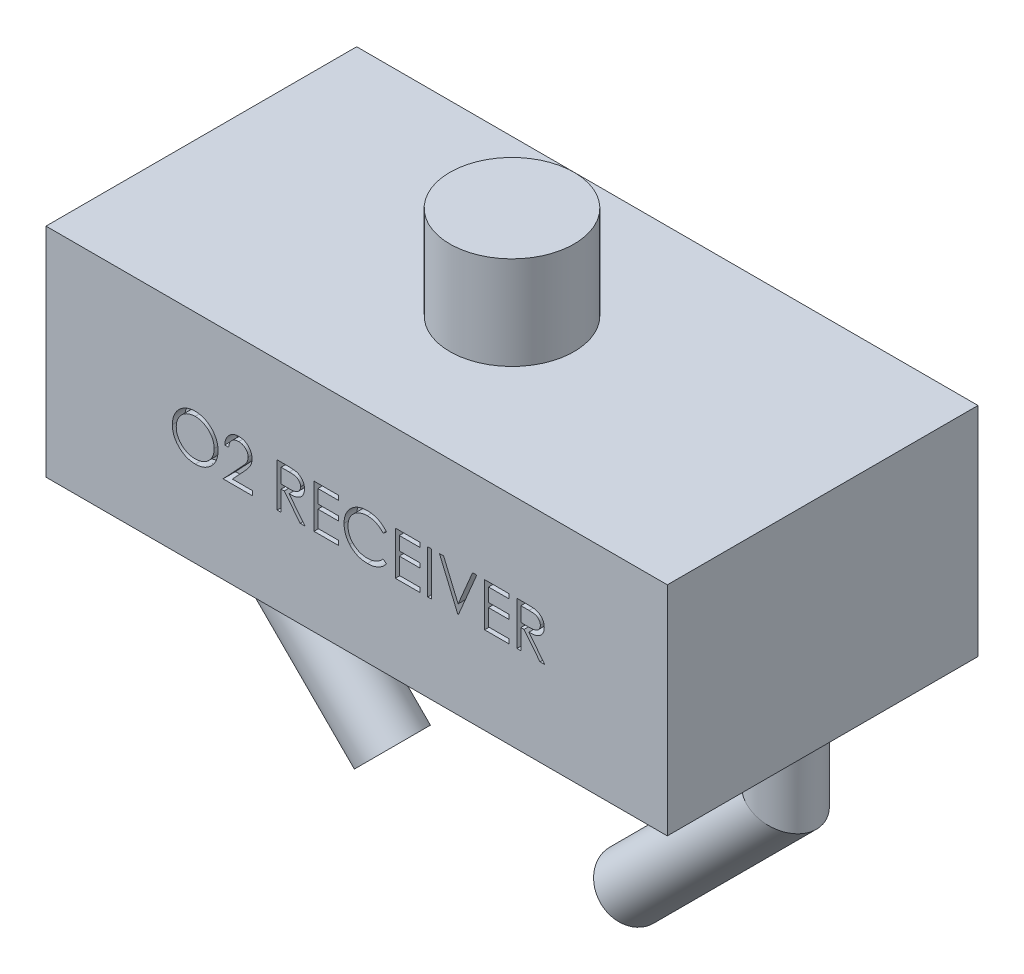
from build123d import *

# Parameters (mm, degrees)
SKETCH1_W           = 50
SKETCH1_H           = 17.5
BOSS_EXTRUDE1_DEPTH = 12.5
SKETCH2_W           = 0.314102564
SKETCH2_H           = 3.5
CUT_EXTRUDE1_DEPTH  = 1
SKETCH3_R           = 5
BOSS_EXTRUDE2_DEPTH = 7.5
SKETCH5_R           = 2.5


with BuildPart() as part:
    # Sketch1 → Boss-Extrude1 (new, symmetric)
    with BuildSketch(Plane.XY):
        Rectangle(SKETCH1_W, SKETCH1_H)
    extrude(amount=BOSS_EXTRUDE1_DEPTH, both=True)

    # Sketch2 → Cut-Extrude1 (cut)
    # profile 1 of 10: a face of its own
    with BuildSketch(Plane.XY.offset(12.5)):
        with BuildLine():
            add(Edge.make_bspline(
                [(-13.016466153, 1.851146313), (-12.951658047, 1.849504833), (-12.82436958, 1.846280832), (-12.637294682, 1.821601729), (-12.458699587, 1.778906339), (-12.287129448, 1.722043356), (-12.124636472, 1.646188971), (-11.969997579, 1.554503823), (-11.823580705, 1.446027364), (-11.687359324, 1.321598137), (-11.562702373, 1.186214683), (-11.452876487, 1.041736773), (-11.360834193, 0.889037971), (-11.285248406, 0.72857714), (-11.225949797, 0.560717172), (-11.185030753, 0.38456317), (-11.158892603, 0.201256479), (-11.155836825, 0.076229615), (-11.154286666, 0.012804967)],
                knots=[0, 0, 0, 0, 1.065120563, 2.091984664, 3.0946048, 4.079830382, 5.057816894, 6.036188127, 7.030412546, 8.04752943, 9.064399622, 10.05169764, 11.02544977, 11.989514704, 12.962713494, 13.945757189, 14.957906945, 16, 16, 16, 16], degree=3))
            add(Edge.make_bspline(
                [(-11.154286666, 0.012804967), (-11.155836598, -0.05015248), (-11.158891695, -0.1742489), (-11.185060472, -0.356392344), (-11.226101472, -0.531483041), (-11.284697738, -0.699228694), (-11.359923217, -0.859806257), (-11.452578388, -1.012793211), (-11.561719599, -1.15823971), (-11.68592645, -1.294552375), (-11.821327492, -1.419549846), (-11.966557759, -1.528468721), (-12.118351079, -1.622192846), (-12.278660787, -1.69697652), (-12.445360823, -1.75674844), (-12.619943147, -1.79750107), (-12.801589701, -1.823788114), (-12.925460704, -1.826806629), (-12.988421281, -1.828340867)],
                knots=[0, 0, 0, 0, 1.043624062, 2.057103931, 3.04512605, 4.022047818, 4.998200453, 5.980619268, 6.982898556, 8.009068085, 9.034988726, 10.034168286, 11.015286542, 11.987931943, 12.962482838, 13.94673481, 14.956375938, 16, 16, 16, 16], degree=3))
            add(Edge.make_bspline(
                [(-12.988421281, -1.828340867), (-13.0518456, -1.82679148), (-13.176871816, -1.823737226), (-13.360408851, -1.797555821), (-13.536686595, -1.756614517), (-13.705200946, -1.698105081), (-13.866045876, -1.62248785), (-14.019535959, -1.530283471), (-14.165055106, -1.42087633), (-14.301396852, -1.296709756), (-14.426146051, -1.161538204), (-14.534905426, -1.016703948), (-14.62713054, -0.865048492), (-14.702493872, -0.706150968), (-14.762158331, -0.540779525), (-14.80286315, -0.367831048), (-14.829199102, -0.188291542), (-14.832233948, -0.066048643), (-14.833773845, -0.004021956)],
                knots=[0, 0, 0, 0, 1.053102029, 2.075944431, 3.073151272, 4.055350789, 5.033113405, 6.020478099, 7.024410459, 8.052272461, 9.079885166, 10.07527673, 11.055994387, 12.023226415, 12.992069828, 13.970394897, 14.97016774, 16, 16, 16, 16], degree=3))
            add(Edge.make_bspline(
                [(-14.833773845, -0.004021956), (-14.83323921, 0.037610713), (-14.832176683, 0.120350836), (-14.819384991, 0.243217436), (-14.80082329, 0.364108094), (-14.774221377, 0.482679042), (-14.73942971, 0.598640027), (-14.698377683, 0.71279079), (-14.648237837, 0.823974513), (-14.591557189, 0.932717905), (-14.528295381, 1.037325811), (-14.458419632, 1.136205394), (-14.384384263, 1.230186391), (-14.30322087, 1.316833395), (-14.217604424, 1.398667051), (-14.126146046, 1.474429768), (-14.029403802, 1.544804719), (-13.926961422, 1.60822506), (-13.821343147, 1.665584195), (-13.71246637, 1.714806046), (-13.601809798, 1.757052107), (-13.48885515, 1.791292932), (-13.373902378, 1.818324968), (-13.256700593, 1.836732322), (-13.137343167, 1.84955664), (-13.056931848, 1.850614142), (-13.016466153, 1.851146313)],
                knots=[0, 0, 0, 0, 1.037015668, 2.060948919, 3.074880161, 4.083647147, 5.086022904, 6.090072063, 7.104153813, 8.122640571, 9.144368836, 10.147691507, 11.138137339, 12.123020368, 13.103399296, 14.087645067, 15.080126199, 16.082011238, 17.087798457, 18.072939717, 19.057185487, 20.037253025, 21.01195951, 21.997135196, 22.992090687, 24, 24, 24, 24], degree=3))
        make_face()
        with BuildLine():
            add(Edge.make_bspline(
                [(-13.001041473, 1.492171954), (-13.034256107, 1.491767064), (-13.10036784, 1.490961154), (-13.198652376, 1.480345438), (-13.29564431, 1.465215549), (-13.391363672, 1.443634029), (-13.485409961, 1.414229976), (-13.578659803, 1.380389068), (-13.670262856, 1.339167977), (-13.759916714, 1.292595273), (-13.846831789, 1.241046352), (-13.928844491, 1.184074585), (-14.006167135, 1.12301603), (-14.078610402, 1.057728193), (-14.145961574, 0.987878591), (-14.209546275, 0.914526155), (-14.266815857, 0.835574264), (-14.319301434, 0.753163857), (-14.366269274, 0.667402276), (-14.408034629, 0.579192414), (-14.442198637, 0.487814727), (-14.470061014, 0.394260569), (-14.493160825, 0.29867811), (-14.507794749, 0.200342261), (-14.518527108, 0.099747149), (-14.519286954, 0.031765295), (-14.519671281, -0.002619713)],
                knots=[0, 0, 0, 0, 1.008559885, 2.007477868, 2.99961109, 3.989939068, 4.984837346, 5.991145699, 7.001802488, 8.033829008, 9.059044045, 10.069351652, 11.065060232, 12.050310815, 13.029377138, 14.011219647, 14.996725999, 15.989392538, 16.977580475, 17.965360261, 18.951710183, 19.937753436, 20.929683414, 21.935841486, 22.955955122, 24, 24, 24, 24], degree=3))
            add(Edge.make_bspline(
                [(-14.519671281, -0.002619713), (-14.518396419, -0.053181934), (-14.515888371, -0.152653464), (-14.493930801, -0.298421608), (-14.460108827, -0.438509894), (-14.41025146, -0.572151803), (-14.347900846, -0.700496086), (-14.270873955, -0.822404191), (-14.17961487, -0.937909065), (-14.075951343, -1.046204334), (-13.962628636, -1.145050139), (-13.842295907, -1.231813547), (-13.716242299, -1.305223797), (-13.584139096, -1.365028869), (-13.446691557, -1.412418607), (-13.303014006, -1.444897238), (-13.154063547, -1.466272694), (-13.052532892, -1.46832545), (-13.001041473, -1.469366508)],
                knots=[0, 0, 0, 0, 1.032063989, 2.030389145, 3.003944642, 3.970395727, 4.937377036, 5.913328081, 6.909231446, 7.93887556, 8.970685674, 9.976071282, 10.964166581, 11.944589148, 12.933237628, 13.927779006, 14.949070134, 16, 16, 16, 16], degree=3))
            add(Edge.make_bspline(
                [(-13.001041473, -1.469366508), (-12.966431972, -1.468891003), (-12.897790935, -1.467947935), (-12.795695413, -1.458449259), (-12.695439201, -1.443217389), (-12.597162921, -1.421286734), (-12.50097811, -1.393839527), (-12.406483307, -1.361231799), (-12.314685017, -1.320550595), (-12.224425179, -1.275602644), (-12.138028937, -1.224362486), (-12.055553405, -1.169324337), (-11.979077425, -1.108355716), (-11.906688353, -1.044037903), (-11.839060664, -0.975074056), (-11.77665168, -0.901553834), (-11.719671548, -0.823013177), (-11.667205901, -0.740727771), (-11.620402639, -0.654731518), (-11.57962354, -0.56620184), (-11.545027424, -0.475356731), (-11.517098919, -0.382065159), (-11.495213457, -0.286504311), (-11.480133537, -0.188546232), (-11.469585099, -0.08838689), (-11.468790022, -0.020643034), (-11.46838923, 0.013506088)],
                knots=[0, 0, 0, 0, 1.047197238, 2.076906641, 3.100256066, 4.114471768, 5.12198147, 6.126382909, 7.136867548, 8.15857795, 9.17633901, 10.174870724, 11.156907918, 12.133735059, 13.104061851, 14.077631395, 15.04955518, 16.038496417, 17.029181396, 18.010275684, 18.986308667, 19.968651475, 20.955262928, 21.950658345, 22.966943676, 24, 24, 24, 24], degree=3))
            add(Edge.make_bspline(
                [(-11.46838923, 0.013506088), (-11.468790343, 0.047421593), (-11.469586024, 0.114699243), (-11.480128499, 0.214160061), (-11.495229389, 0.311413273), (-11.516992097, 0.406077076), (-11.545042251, 0.498175601), (-11.579629581, 0.587622348), (-11.620414881, 0.674750544), (-11.667223105, 0.759344841), (-11.719838929, 0.840519579), (-11.777333172, 0.918121991), (-11.84069852, 0.990694732), (-11.908124545, 1.060029426), (-11.98129543, 1.124647316), (-12.059879724, 1.184569837), (-12.142923402, 1.241243111), (-12.230850638, 1.292368673), (-12.321594591, 1.339582906), (-12.414708549, 1.380033909), (-12.509137649, 1.414406028), (-12.604641761, 1.443722993), (-12.70202474, 1.465131023), (-12.800628568, 1.480359073), (-12.900316827, 1.490957459), (-12.967360047, 1.491765838), (-13.001041473, 1.492171954)],
                knots=[0, 0, 0, 0, 1.02996197, 2.043119294, 3.035359645, 4.018872909, 4.991431989, 5.957985074, 6.929999688, 7.912076566, 8.892894881, 9.867085534, 10.843653904, 11.817741046, 12.803660682, 13.806313499, 14.818574707, 15.856120519, 16.894564902, 17.924820532, 18.937903209, 19.946497019, 20.957711757, 21.963978472, 22.977135795, 24, 24, 24, 24], degree=3))
        make_face(mode=Mode.SUBTRACT)
    # profile 2 of 10: a face of its own
    with BuildSketch(Plane.XY.offset(12.5)):
        with BuildLine():
            Line((-10.301722563, 0.684479646), (-10.615825127, 0.684479646))
            add(Edge.make_bspline(
                [(-10.615825127, 0.684479646), (-10.613777974, 0.726150534), (-10.60975742, 0.807991048), (-10.590929131, 0.927314955), (-10.563988254, 1.041369754), (-10.5258968, 1.149239668), (-10.478590522, 1.251878475), (-10.421860494, 1.34887849), (-10.354666644, 1.439869679), (-10.27845991, 1.524008522), (-10.195691271, 1.601196093), (-10.106385331, 1.667851336), (-10.012540304, 1.724169007), (-9.914440905, 1.771250249), (-9.810980342, 1.806590095), (-9.703097484, 1.832811735), (-9.590318347, 1.848588081), (-9.513478325, 1.850283866), (-9.474398845, 1.851146313)],
                knots=[0, 0, 0, 0, 1.10065271, 2.161652631, 3.183658789, 4.190468796, 5.17591951, 6.163126047, 7.15150782, 8.156236427, 9.156009102, 10.134482811, 11.092018607, 12.041330605, 13.001268258, 13.972401359, 14.968799086, 16, 16, 16, 16], degree=3))
            add(Edge.make_bspline(
                [(-9.474398845, 1.851146313), (-9.436020771, 1.850247856), (-9.360609226, 1.848482421), (-9.250547212, 1.833321392), (-9.145769917, 1.809575801), (-9.046482151, 1.776260384), (-8.953476086, 1.731475957), (-8.866053042, 1.677678418), (-8.783172231, 1.615458587), (-8.708565447, 1.542204773), (-8.640057368, 1.464002389), (-8.580955113, 1.380514485), (-8.53034195, 1.2942852), (-8.48815427, 1.204656998), (-8.457098131, 1.11078597), (-8.433519923, 1.014038767), (-8.420192509, 0.913413956), (-8.418147085, 0.8453074), (-8.417107178, 0.810681569)],
                knots=[0, 0, 0, 0, 1.111607364, 2.184268762, 3.212621178, 4.221274766, 5.211760367, 6.196651075, 7.1921475, 8.207485113, 9.220403448, 10.201281604, 11.166441695, 12.114753415, 13.065576456, 14.026450734, 14.996634279, 16, 16, 16, 16], degree=3))
            add(Edge.make_bspline(
                [(-8.417107178, 0.810681569), (-8.418800441, 0.761933735), (-8.422157253, 0.665293521), (-8.450871629, 0.523278658), (-8.49571814, 0.385685239), (-8.549715497, 0.274947937), (-8.604187941, 0.185714443), (-8.653275449, 0.112245738), (-8.71074026, 0.03314027), (-8.777418758, -0.051337067), (-8.85193163, -0.141847973), (-8.934953793, -0.238337768), (-9.027077275, -0.339809538), (-9.091735776, -0.409115139), (-9.125240191, -0.445027565)],
                knots=[0, 0, 0, 0, 1.184426356, 2.348067706, 3.509069118, 4.696110526, 5.333549288, 6.050745305, 6.844228056, 7.710549037, 8.667450064, 9.695053472, 10.805634456, 12, 12, 12, 12], degree=3))
            Line((-9.125240191, -0.445027565), (-10.000941313, -1.379622918))
            Line((-10.000941313, -1.379622918), (-8.372235384, -1.379622918))
            Line((-8.372235384, -1.379622918), (-8.372235384, -1.738597277))
            Line((-8.372235384, -1.738597277), (-10.750440512, -1.738597277))
            Line((-10.750440512, -1.738597277), (-9.393068717, -0.290079649))
            add(Edge.make_bspline(
                [(-9.393068717, -0.290079649), (-9.36002083, -0.255581342), (-9.296542603, -0.189317156), (-9.206760026, -0.092574195), (-9.126121038, -0.002824655), (-9.054103645, 0.079761894), (-8.99227014, 0.156393462), (-8.937397908, 0.224588165), (-8.893432317, 0.287342615), (-8.845716921, 0.360083229), (-8.79950294, 0.448895546), (-8.759790584, 0.557429236), (-8.735575735, 0.669156488), (-8.7326709, 0.744658525), (-8.731209743, 0.782636697)],
                knots=[0, 0, 0, 0, 1.329631726, 2.553950428, 3.673215718, 4.687767853, 5.603093632, 6.413772471, 7.123043292, 7.734684054, 8.834405432, 9.900288307, 10.943827018, 12, 12, 12, 12], degree=3))
            add(Edge.make_bspline(
                [(-8.731209743, 0.782636697), (-8.731845485, 0.806518096), (-8.733098411, 0.853583746), (-8.744156108, 0.922589505), (-8.760866614, 0.989154319), (-8.784811872, 1.053482938), (-8.816418613, 1.11492859), (-8.854891992, 1.17356607), (-8.899282056, 1.230255036), (-8.950633325, 1.283408334), (-9.007044845, 1.332089539), (-9.066639095, 1.375213625), (-9.129689199, 1.411252735), (-9.195929321, 1.440796233), (-9.26517479, 1.463971614), (-9.337559536, 1.480030193), (-9.412883552, 1.490112677), (-9.464317048, 1.491476849), (-9.490524646, 1.492171954)],
                knots=[0, 0, 0, 0, 0.991446411, 1.95395049, 2.89581595, 3.838931463, 4.798493298, 5.75982156, 6.748411868, 7.785213223, 8.824556874, 9.840280684, 10.836137867, 11.835679398, 12.848801643, 13.863922112, 14.911575587, 16, 16, 16, 16], degree=3))
            add(Edge.make_bspline(
                [(-9.490524646, 1.492171954), (-9.517895479, 1.491456922), (-9.571647275, 1.490052716), (-9.650566308, 1.480230052), (-9.725852086, 1.463284212), (-9.797693989, 1.440107537), (-9.866213575, 1.410648989), (-9.931077619, 1.373957244), (-9.992140508, 1.330173751), (-10.049517031, 1.280533194), (-10.10238101, 1.225265593), (-10.148827886, 1.16365563), (-10.1894119, 1.096828215), (-10.224821134, 1.024963664), (-10.253576824, 0.947409884), (-10.275549974, 0.864442179), (-10.292936821, 0.776420798), (-10.298745342, 0.715635713), (-10.301722563, 0.684479646)],
                knots=[0, 0, 0, 0, 1.031018746, 2.02475058, 2.990194455, 3.934040569, 4.864654155, 5.795059489, 6.735614925, 7.690564532, 8.649604399, 9.611025574, 10.590972636, 11.591080095, 12.624614302, 13.701020113, 14.821632451, 16, 16, 16, 16], degree=3))
        make_face()
    # profile 3 of 10: a face of its own
    with BuildSketch(Plane.XY.offset(12.5)):
        with BuildLine():
            Line((-6.397876409, 1.761402723), (-5.697455736, 1.761402723))
            add(Edge.make_bspline(
                [(-5.697455736, 1.761402723), (-5.650714608, 1.761247137), (-5.560966463, 1.760948395), (-5.432393193, 1.759282632), (-5.315566096, 1.754508276), (-5.210546257, 1.750399693), (-5.117335602, 1.742907751), (-5.035648311, 1.735747104), (-4.965860613, 1.726373443), (-4.923614762, 1.71766802), (-4.904486986, 1.713726441)],
                knots=[0, 0, 0, 0, 1.410062039, 2.707475311, 3.878576406, 4.937260626, 5.877586885, 6.699081471, 7.410979367, 8, 8, 8, 8], degree=3))
            add(Edge.make_bspline(
                [(-4.904486986, 1.713726441), (-4.878880362, 1.707399676), (-4.828213373, 1.694881112), (-4.755263306, 1.668421511), (-4.685748983, 1.637801887), (-4.619959158, 1.601838166), (-4.558223367, 1.560263387), (-4.499905056, 1.513795264), (-4.444739593, 1.462688058), (-4.394957963, 1.405653217), (-4.348018911, 1.345816707), (-4.308430284, 1.28111295), (-4.274303805, 1.213451423), (-4.247133288, 1.142144005), (-4.225255314, 1.067882233), (-4.209829075, 0.989993436), (-4.200577887, 0.908832461), (-4.199636032, 0.853474553), (-4.19915846, 0.825405127)],
                knots=[0, 0, 0, 0, 1.027469482, 2.033020251, 3.019912614, 3.986113645, 4.951240523, 5.91722682, 6.890402269, 7.87763091, 8.8651537, 9.85103654, 10.82876324, 11.815024772, 12.821070561, 13.842952187, 14.906261191, 16, 16, 16, 16], degree=3))
            add(Edge.make_bspline(
                [(-4.19915846, 0.825405127), (-4.200627459, 0.778770022), (-4.203493854, 0.687772854), (-4.230218958, 0.555711973), (-4.273995478, 0.432522658), (-4.334318767, 0.31836002), (-4.411138243, 0.215449375), (-4.503463034, 0.12505892), (-4.611344645, 0.049419007), (-4.711773961, -0.003033798), (-4.800488161, -0.036626706), (-4.873521474, -0.060263065), (-4.953188451, -0.07852503), (-5.038725786, -0.094885162), (-5.130489441, -0.107236856), (-5.228259481, -0.116283451), (-5.332105632, -0.1219375), (-5.403444701, -0.122779505), (-5.440144037, -0.123212662)],
                knots=[0, 0, 0, 0, 1.260483769, 2.459530307, 3.627416485, 4.787058657, 5.939039949, 7.08810263, 8.267026773, 9.491475466, 10.141966685, 10.831826277, 11.566392101, 12.351337768, 13.187381173, 14.07005841, 15.007169909, 16, 16, 16, 16], degree=3))
            Line((-5.440144037, -0.123212662), (-4.154286666, -1.738597277))
            Line((-4.154286666, -1.738597277), (-4.54270814, -1.738597277))
            Line((-4.54270814, -1.738597277), (-5.828565512, -0.123212662))
            Line((-5.828565512, -0.123212662), (-6.083773845, -0.123212662))
            Line((-6.083773845, -0.123212662), (-6.083773845, -1.738597277))
            Line((-6.083773845, -1.738597277), (-6.397876409, -1.738597277))
            Line((-6.397876409, -1.738597277), (-6.397876409, 1.761402723))
        make_face()
        with BuildLine():
            Line((-6.083773845, 1.402428364), (-6.083773845, 0.235761697))
            Line((-6.083773845, 0.235761697), (-5.442948525, 0.230853845))
            add(Edge.make_bspline(
                [(-5.442948525, 0.230853845), (-5.413028486, 0.230840608), (-5.355034929, 0.230814952), (-5.271134264, 0.234808728), (-5.193014152, 0.239352046), (-5.1209734, 0.246301392), (-5.054979825, 0.255257464), (-4.995066411, 0.266460448), (-4.941135359, 0.27951251), (-4.878236821, 0.299714136), (-4.80800029, 0.331720154), (-4.73166883, 0.378285653), (-4.666666492, 0.436854772), (-4.61174863, 0.503828228), (-4.567619198, 0.577464477), (-4.536507144, 0.656880846), (-4.516764702, 0.740072444), (-4.514436156, 0.797250552), (-4.513261025, 0.826106249)],
                knots=[0, 0, 0, 0, 1.146690395, 2.22261258, 3.21895312, 4.145990853, 4.996080663, 5.770904154, 6.481378293, 7.121626537, 8.300444488, 9.431385265, 10.535395872, 11.636531494, 12.74115979, 13.810798291, 14.895190096, 16, 16, 16, 16], degree=3))
            add(Edge.make_bspline(
                [(-4.513261025, 0.826106249), (-4.514463146, 0.854252822), (-4.516845311, 0.910029061), (-4.53629408, 0.991684971), (-4.569183461, 1.068751921), (-4.613505699, 1.140916406), (-4.667504854, 1.206422142), (-4.730822666, 1.262469295), (-4.801727862, 1.30871876), (-4.86799906, 1.338273141), (-4.927233272, 1.356392994), (-4.978662933, 1.369144158), (-5.03677441, 1.379388627), (-5.101849869, 1.387596687), (-5.1736115, 1.394651632), (-5.252422151, 1.39940341), (-5.337758931, 1.402217274), (-5.396905862, 1.402356363), (-5.427523845, 1.402428364)],
                knots=[0, 0, 0, 0, 1.101028733, 2.181837193, 3.264309656, 4.369019818, 5.486613113, 6.575447106, 7.666700264, 8.788928104, 9.402425223, 10.0903467, 10.862060571, 11.710948788, 12.657782767, 13.684531032, 14.801375019, 16, 16, 16, 16], degree=3))
            Line((-5.427523845, 1.402428364), (-6.083773845, 1.402428364))
        make_face(mode=Mode.SUBTRACT)
    # profile 4 of 10: a face of its own
    with BuildSketch(Plane.XY.offset(12.5)):
        Polygon((-3.436337948, 1.761402723), (-1.461978973, 1.761402723), (-1.461978973, 1.402428364), (-3.122235384, 1.402428364), (-3.122235384, 0.325505287), (-1.461978973, 0.325505287), (-1.461978973, -0.033469072), (-3.122235384, -0.033469072), (-3.122235384, -1.379622918), (-1.461978973, -1.379622918), (-1.461978973, -1.738597277), (-3.436337948, -1.738597277), align=None)
    # profile 5 of 10: a face of its own
    with BuildSketch(Plane.XY.offset(12.5)):
        with BuildLine():
            Line((2.396995386, 1.119175159), (2.122155642, 0.90883862))
            add(Edge.make_bspline(
                [(2.122155642, 0.90883862), (2.102549754, 0.93220459), (2.063602307, 0.978621506), (2.000943104, 1.04380105), (1.935641461, 1.104866312), (1.86772234, 1.162108192), (1.795963221, 1.213524957), (1.722102422, 1.26179606), (1.644904377, 1.305063798), (1.538152642, 1.357526784), (1.398504794, 1.412272939), (1.222709955, 1.458176171), (1.039198856, 1.487397346), (0.914001257, 1.490562188), (0.850320706, 1.492171954)],
                knots=[0, 0, 0, 0, 0.757959112, 1.505699292, 2.245454638, 2.979532153, 3.711538275, 4.438200793, 5.171680507, 5.909471876, 7.393775596, 8.890124382, 10.418191784, 12, 12, 12, 12], degree=3))
            add(Edge.make_bspline(
                [(0.850320706, 1.492171954), (0.815237407, 1.491767991), (0.745396414, 1.490963815), (0.641747941, 1.48035469), (0.54003489, 1.46544348), (0.440323423, 1.443318157), (0.342740465, 1.415345538), (0.246648063, 1.381920124), (0.153437463, 1.340565284), (0.061819225, 1.294857024), (-0.025959986, 1.243229579), (-0.109015034, 1.186916227), (-0.187043002, 1.126547131), (-0.260105614, 1.061896025), (-0.328277562, 0.993254064), (-0.391064873, 0.919889723), (-0.448250283, 0.842037549), (-0.500967308, 0.760724142), (-0.548180042, 0.67618635), (-0.587709921, 0.588111279), (-0.622715043, 0.498007176), (-0.650414286, 0.404856016), (-0.672338803, 0.30931325), (-0.687466466, 0.211122462), (-0.697954937, 0.110488782), (-0.698755114, 0.04227947), (-0.69915846, 0.007897114)],
                knots=[0, 0, 0, 0, 1.054917814, 2.100044995, 3.131103042, 4.146048494, 5.169673617, 6.183595914, 7.203665975, 8.234915748, 9.262203917, 10.264457458, 11.251630812, 12.227803204, 13.197192746, 14.159520551, 15.12972552, 16.100847026, 17.073214652, 18.039054194, 19.002613845, 19.979014051, 20.95965708, 21.949030935, 22.966165397, 24, 24, 24, 24], degree=3))
            add(Edge.make_bspline(
                [(-0.69915846, 0.007897114), (-0.697896641, -0.043834206), (-0.695419227, -0.145401791), (-0.673370893, -0.294172401), (-0.639865802, -0.436693075), (-0.589650225, -0.572072917), (-0.527731174, -0.701981275), (-0.449490563, -0.824220129), (-0.358874025, -0.940636693), (-0.254599606, -1.048479641), (-0.14019379, -1.146993366), (-0.017445878, -1.233743948), (0.113338409, -1.30605883), (0.25071504, -1.366234777), (0.395741153, -1.412491505), (0.548155956, -1.445055628), (0.707627951, -1.466297809), (0.816597351, -1.468331497), (0.872055482, -1.469366508)],
                knots=[0, 0, 0, 0, 1.029171465, 2.020641659, 2.987623507, 3.938342917, 4.889210282, 5.84687017, 6.821220943, 7.821438502, 8.827599549, 9.822697543, 10.807740252, 11.797342354, 12.80366471, 13.83203677, 14.896651826, 16, 16, 16, 16], degree=3))
            add(Edge.make_bspline(
                [(0.872055482, -1.469366508), (0.933158171, -1.467677728), (1.05342288, -1.464353805), (1.229790906, -1.436194556), (1.398626672, -1.390536639), (1.559939258, -1.326638716), (1.713273904, -1.243573428), (1.858870565, -1.142875551), (1.996852135, -1.023587218), (2.079823418, -0.93250409), (2.122155642, -0.886033174)],
                knots=[0, 0, 0, 0, 1.028121516, 2.023589091, 2.998037872, 3.967518031, 4.937445131, 5.927275754, 6.942489185, 8, 8, 8, 8], degree=3))
            Line((2.122155642, -0.886033174), (2.396995386, -1.094266347))
            add(Edge.make_bspline(
                [(2.396995386, -1.094266347), (2.374877276, -1.122804799), (2.330747001, -1.179745006), (2.259288984, -1.260016715), (2.184011686, -1.335520751), (2.104355976, -1.405648372), (2.021238185, -1.471802838), (1.933165872, -1.532104669), (1.84129684, -1.587395553), (1.745942361, -1.638022478), (1.647203748, -1.682939725), (1.545199313, -1.721393493), (1.440368738, -1.754518382), (1.332707229, -1.781770319), (1.221991472, -1.803041403), (1.108620998, -1.817261078), (0.992351123, -1.827002992), (0.913909702, -1.827890908), (0.874158847, -1.828340867)],
                knots=[0, 0, 0, 0, 0.986787822, 1.968848986, 2.935600012, 3.899624008, 4.868462664, 5.837806735, 6.815139263, 7.798259679, 8.787526145, 9.778297419, 10.776456485, 11.791383307, 12.812564526, 13.85620153, 14.913611965, 16, 16, 16, 16], degree=3))
            add(Edge.make_bspline(
                [(0.874158847, -1.828340867), (0.83651518, -1.828078874), (0.76207949, -1.827560816), (0.652180738, -1.819168649), (0.545191158, -1.807718912), (0.441416532, -1.790478781), (0.340290557, -1.770134441), (0.242729972, -1.742863184), (0.147774762, -1.712314018), (0.055806421, -1.676409031), (-0.033253279, -1.635892848), (-0.11911709, -1.590101289), (-0.201745522, -1.539419425), (-0.281950943, -1.484964414), (-0.358548527, -1.424987113), (-0.432202052, -1.360320478), (-0.503324528, -1.291182467), (-0.547327213, -1.241327614), (-0.569450928, -1.21626154)],
                knots=[0, 0, 0, 0, 1.114604814, 2.203992996, 3.262667896, 4.300477797, 5.318619304, 6.316056647, 7.298880507, 8.271930387, 9.238335007, 10.195173496, 11.151986948, 12.108099108, 13.064862484, 14.031167946, 15.010108607, 16, 16, 16, 16], degree=3))
            add(Edge.make_bspline(
                [(-0.569450928, -1.21626154), (-0.604886572, -1.172720351), (-0.675330049, -1.08616364), (-0.765455732, -0.945877659), (-0.842603288, -0.79940945), (-0.904979208, -0.645989522), (-0.953741941, -0.485962134), (-0.987523137, -0.31924662), (-1.009474741, -0.145998678), (-1.01198503, -0.028161889), (-1.013261025, 0.031735255)],
                knots=[0, 0, 0, 0, 0.994628077, 1.977248131, 2.950237994, 3.925870899, 4.908910175, 5.911660606, 6.938484602, 8, 8, 8, 8], degree=3))
            add(Edge.make_bspline(
                [(-1.013261025, 0.031735255), (-1.011705831, 0.094690709), (-1.008646085, 0.218551633), (-0.982650289, 0.400325586), (-0.940831493, 0.574476985), (-0.881434605, 0.74068073), (-0.806129253, 0.89981101), (-0.713102639, 1.050652215), (-0.603435497, 1.194169015), (-0.477987929, 1.328183766), (-0.340420594, 1.450723119), (-0.19310178, 1.558529322), (-0.036319833, 1.648246838), (0.128198018, 1.723243001), (0.3016837, 1.780887464), (0.483767069, 1.821240651), (0.674105984, 1.846357767), (0.803968409, 1.849532975), (0.869952116, 1.851146313)],
                knots=[0, 0, 0, 0, 1.032925535, 2.032216505, 3.007276963, 3.968222605, 4.92396291, 5.891752235, 6.871517503, 7.883894988, 8.900124299, 9.891468569, 10.874487609, 11.85992873, 12.854644235, 13.869047385, 14.917252991, 16, 16, 16, 16], degree=3))
            add(Edge.make_bspline(
                [(0.869952116, 1.851146313), (0.910166588, 1.850664175), (0.989767086, 1.849709831), (1.107519738, 1.840403688), (1.222162065, 1.824890082), (1.333773047, 1.803774012), (1.442895663, 1.777566691), (1.548695904, 1.743426393), (1.651794591, 1.704389861), (1.751541499, 1.659431395), (1.847458049, 1.608964654), (1.939514368, 1.55354903), (2.026979227, 1.493253225), (2.110468075, 1.42859005), (2.188584286, 1.35819149), (2.263545765, 1.283993894), (2.332806843, 1.20386007), (2.375560038, 1.147455136), (2.396995386, 1.119175159)],
                knots=[0, 0, 0, 0, 1.096760587, 2.17092713, 3.219439832, 4.250915756, 5.268269357, 6.278326846, 7.281116186, 8.274029601, 9.260640565, 10.235837813, 11.203064059, 12.156899882, 13.114053108, 14.069676657, 15.032185724, 16, 16, 16, 16], degree=3))
        make_face()
    # profile 6 of 10: a face of its own
    with BuildSketch(Plane.XY.offset(12.5)):
        Polygon((3.114944104, 1.761402723), (5.089303078, 1.761402723), (5.089303078, 1.402428364), (3.429046668, 1.402428364), (3.429046668, 0.325505287), (5.089303078, 0.325505287), (5.089303078, -0.033469072), (3.429046668, -0.033469072), (3.429046668, -1.379622918), (5.089303078, -1.379622918), (5.089303078, -1.738597277), (3.114944104, -1.738597277), align=None)
    # profile 7 of 10: a face of its own
    with BuildSketch(Plane.XY.offset(12.5)):
        with Locations((5.874559488, 0.011402723)):
            Rectangle(SKETCH2_W, SKETCH2_H)
    # profile 8 of 10: a face of its own
    with BuildSketch(Plane.XY.offset(12.5)):
        Polygon((6.659815898, 1.761402723), (6.99635436, 1.761402723), (8.163021027, -0.996810418), (9.329687693, 1.761402723), (9.666226155, 1.761402723), (8.185456924, -1.738597277), (8.140585129, -1.738597277), align=None)
    # profile 9 of 10: a face of its own
    with BuildSketch(Plane.XY.offset(12.5)):
        Polygon((10.294431283, 1.761402723), (12.268790257, 1.761402723), (12.268790257, 1.402428364), (10.608533847, 1.402428364), (10.608533847, 0.325505287), (12.268790257, 0.325505287), (12.268790257, -0.033469072), (10.608533847, -0.033469072), (10.608533847, -1.379622918), (12.268790257, -1.379622918), (12.268790257, -1.738597277), (10.294431283, -1.738597277), align=None)
    # profile 10 of 10: a face of its own
    with BuildSketch(Plane.XY.offset(12.5)):
        with BuildLine():
            Line((12.896995386, 1.761402723), (13.597416059, 1.761402723))
            add(Edge.make_bspline(
                [(13.597416059, 1.761402723), (13.644157187, 1.761247137), (13.733905332, 1.760948395), (13.862478602, 1.759282632), (13.979305699, 1.754508276), (14.084325538, 1.750399693), (14.177536193, 1.742907751), (14.259223484, 1.735747104), (14.329011182, 1.726373443), (14.371257033, 1.71766802), (14.390384809, 1.713726441)],
                knots=[0, 0, 0, 0, 1.410062039, 2.707475311, 3.878576406, 4.937260626, 5.877586885, 6.699081471, 7.410979367, 8, 8, 8, 8], degree=3))
            add(Edge.make_bspline(
                [(14.390384809, 1.713726441), (14.415991433, 1.707399676), (14.466658422, 1.694881112), (14.539608488, 1.668421511), (14.609122812, 1.637801887), (14.674912637, 1.601838166), (14.736648428, 1.560263387), (14.794966739, 1.513795264), (14.850132202, 1.462688058), (14.899913832, 1.405653217), (14.946852884, 1.345816707), (14.98644151, 1.28111295), (15.02056799, 1.213451423), (15.047738507, 1.142144005), (15.069616481, 1.067882233), (15.08504272, 0.989993436), (15.094293908, 0.908832461), (15.095235763, 0.853474553), (15.095713334, 0.825405127)],
                knots=[0, 0, 0, 0, 1.027469482, 2.033020251, 3.019912614, 3.986113645, 4.951240523, 5.91722682, 6.890402269, 7.87763091, 8.8651537, 9.85103654, 10.82876324, 11.815024772, 12.821070561, 13.842952187, 14.906261191, 16, 16, 16, 16], degree=3))
            add(Edge.make_bspline(
                [(15.095713334, 0.825405127), (15.094244336, 0.778770022), (15.09137794, 0.687772854), (15.064652837, 0.555711973), (15.020876317, 0.432522658), (14.960553028, 0.31836002), (14.883733552, 0.215449375), (14.791408761, 0.12505892), (14.68352715, 0.049419007), (14.583097834, -0.003033798), (14.494383634, -0.036626706), (14.421350321, -0.060263065), (14.341683344, -0.07852503), (14.256146009, -0.094885162), (14.164382354, -0.107236856), (14.066612314, -0.116283451), (13.962766163, -0.1219375), (13.891427093, -0.122779505), (13.854727757, -0.123212662)],
                knots=[0, 0, 0, 0, 1.260483769, 2.459530307, 3.627416485, 4.787058657, 5.939039949, 7.08810263, 8.267026773, 9.491475466, 10.141966685, 10.831826277, 11.566392101, 12.351337768, 13.187381173, 14.07005841, 15.007169909, 16, 16, 16, 16], degree=3))
            Line((13.854727757, -0.123212662), (15.140585129, -1.738597277))
            Line((15.140585129, -1.738597277), (14.752163655, -1.738597277))
            Line((14.752163655, -1.738597277), (13.466306283, -0.123212662))
            Line((13.466306283, -0.123212662), (13.21109795, -0.123212662))
            Line((13.21109795, -0.123212662), (13.21109795, -1.738597277))
            Line((13.21109795, -1.738597277), (12.896995386, -1.738597277))
            Line((12.896995386, -1.738597277), (12.896995386, 1.761402723))
        make_face()
        with BuildLine():
            Line((13.21109795, 1.402428364), (13.21109795, 0.235761697))
            Line((13.21109795, 0.235761697), (13.85192327, 0.230853845))
            add(Edge.make_bspline(
                [(13.85192327, 0.230853845), (13.881843309, 0.230840608), (13.939836866, 0.230814952), (14.023737531, 0.234808728), (14.101857643, 0.239352046), (14.173898395, 0.246301392), (14.23989197, 0.255257464), (14.299805384, 0.266460448), (14.353736435, 0.27951251), (14.416634974, 0.299714136), (14.486871505, 0.331720154), (14.563202965, 0.378285653), (14.628205303, 0.436854772), (14.683123165, 0.503828228), (14.727252597, 0.577464477), (14.758364651, 0.656880846), (14.778107093, 0.740072444), (14.780435639, 0.797250552), (14.78161077, 0.826106249)],
                knots=[0, 0, 0, 0, 1.146690395, 2.22261258, 3.21895312, 4.145990853, 4.996080663, 5.770904154, 6.481378293, 7.121626537, 8.300444488, 9.431385265, 10.535395872, 11.636531494, 12.74115979, 13.810798291, 14.895190096, 16, 16, 16, 16], degree=3))
            add(Edge.make_bspline(
                [(14.78161077, 0.826106249), (14.780408649, 0.854252822), (14.778026484, 0.910029061), (14.758577715, 0.991684971), (14.725688334, 1.068751921), (14.681366096, 1.140916406), (14.627366941, 1.206422142), (14.564049128, 1.262469295), (14.493143933, 1.30871876), (14.426872735, 1.338273141), (14.367638522, 1.356392994), (14.316208862, 1.369144158), (14.258097385, 1.379388627), (14.193021926, 1.387596687), (14.121260295, 1.394651632), (14.042449644, 1.39940341), (13.957112864, 1.402217274), (13.897965933, 1.402356363), (13.86734795, 1.402428364)],
                knots=[0, 0, 0, 0, 1.101028733, 2.181837193, 3.264309656, 4.369019818, 5.486613113, 6.575447106, 7.666700264, 8.788928104, 9.402425223, 10.0903467, 10.862060571, 11.710948788, 12.657782767, 13.684531032, 14.801375019, 16, 16, 16, 16], degree=3))
            Line((13.86734795, 1.402428364), (13.21109795, 1.402428364))
        make_face(mode=Mode.SUBTRACT)
    extrude(amount=-CUT_EXTRUDE1_DEPTH, mode=Mode.SUBTRACT)

    # Sketch3 → Boss-Extrude2 (add)
    with BuildSketch(Plane(origin=(0, 8.75, 0), x_dir=(1, 0, 0), z_dir=(0, 1, 0))):
        with Locations(Location((0, 0, 0), (0, 0, 180))):
            Circle(SKETCH3_R)
    extrude(amount=BOSS_EXTRUDE2_DEPTH)

    # Sweep1: sweep along a path in Sketch4
    with BuildLine(Plane.XY) as sweep1_path:
        Line((-22, -8.75), (-22, -13.75))
        Line((-22, -13.75), (-9.625631329, -26.124368671))
    # Sketch5 → Sweep1 (sweep)
    with BuildSketch(Plane.XZ.offset(8.75)):
        with Locations((-22, 0)):
            Circle(SKETCH5_R)
    sweep1 = sweep(path=sweep1_path.line, transition=Transition.RIGHT)

    # Mirror1: Sweep1 across plane
    add(sweep1.mirror(Plane(origin=(0, 0, 0), x_dir=(0, 0, 1), z_dir=(1, 0, 0))))


solid = part.part
